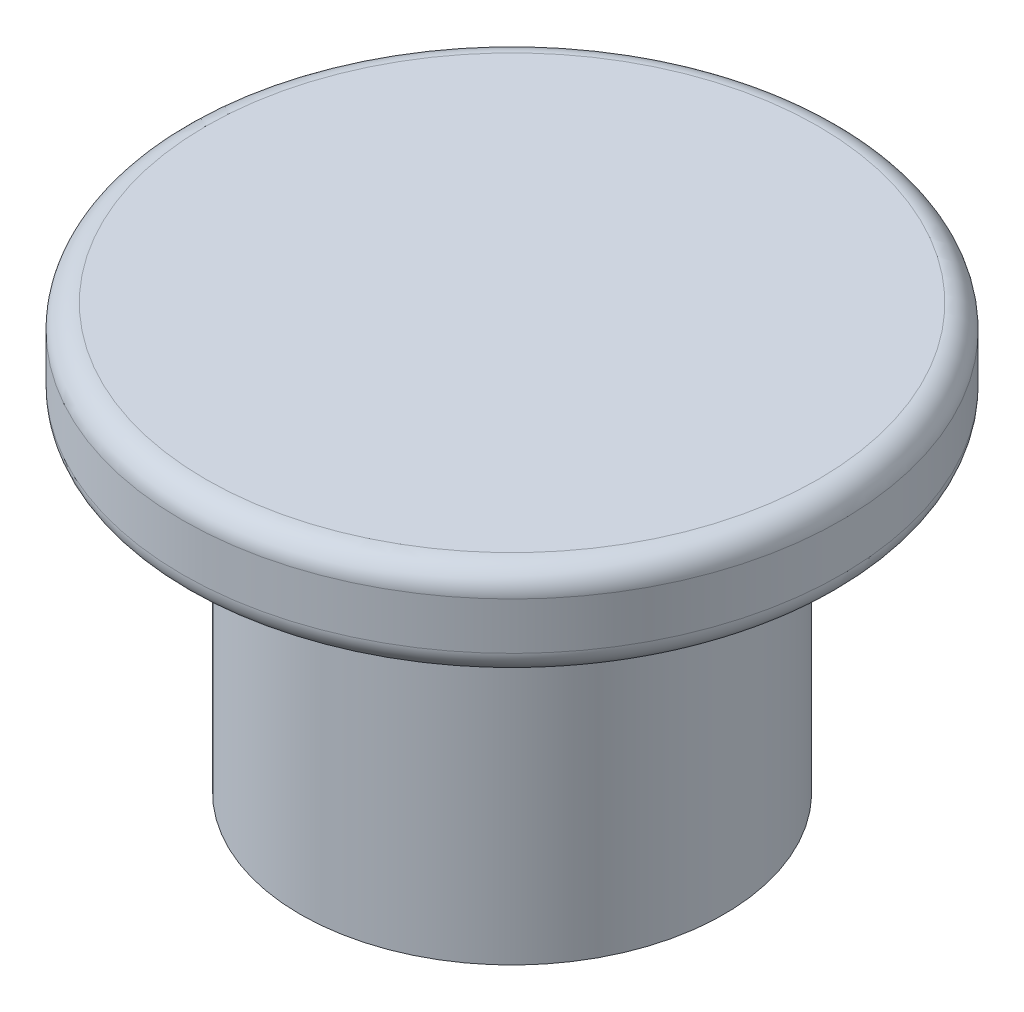
from build123d import *

# Parameters (mm, degrees)
SKETCH1_R                              = 3.5
BOSS_EXTRUDE1_DEPTH                    = 1
SKETCH3_R                              = 2.25
BOSS_EXTRUDE3_DEPTH                    = 3.5
FILLET1_R                              = 0.25
F_1_16_0_07874016_DIAMETER_HOLE1_D     = 2.000000064
F_1_16_0_07874016_DIAMETER_HOLE1_DEPTH = 1.899139362
F_1_16_0_07874016_DIAMETER_HOLE1_TIP   = 0.600860638
FILLET2_R                              = 0.15


with BuildPart() as part:
    # Sketch1 → Boss-Extrude1 (new body)
    with BuildSketch(Plane(origin=(0, 0, 0), x_dir=(1, 0, 0), z_dir=(0, 1, 0))):
        with Locations(Location((0, 0, 0), (0, 0, 270))):
            Circle(SKETCH1_R)
    extrude(amount=BOSS_EXTRUDE1_DEPTH)

    # Sketch3 → Boss-Extrude3 (add)
    with BuildSketch(Plane.XZ):
        with Locations(Location((0, 0, 0), (0, 0, 270))):
            Circle(SKETCH3_R)
    extrude(amount=BOSS_EXTRUDE3_DEPTH)

    # Fillet1
    fillet1_edges = [part.edges().sort_by_distance(p)[0] for p in [
        (0, 0, -3.5),
        (0, 1, -3.5),
    ]]
    fillet(fillet1_edges, radius=FILLET1_R)

    # 1/16 (0.07874016) Diameter Hole1
    with Locations(Plane(origin=(0, -3.5, 0), x_dir=(-1, 0, 0), z_dir=(0, -1, 0))):
        with Locations((0, 0)):
            Hole(F_1_16_0_07874016_DIAMETER_HOLE1_D / 2, depth=F_1_16_0_07874016_DIAMETER_HOLE1_DEPTH)
            with Locations((0, 0, -(F_1_16_0_07874016_DIAMETER_HOLE1_DEPTH + F_1_16_0_07874016_DIAMETER_HOLE1_TIP / 2))):  # 118° drill point
                Cone(0, F_1_16_0_07874016_DIAMETER_HOLE1_D / 2, F_1_16_0_07874016_DIAMETER_HOLE1_TIP, mode=Mode.SUBTRACT)

    # Fillet2
    fillet2_edges = [part.edges().sort_by_distance(p)[0] for p in [
        (-1.000000032, -3.5, 0),
    ]]
    fillet(fillet2_edges, radius=FILLET2_R)


solid = part.part
